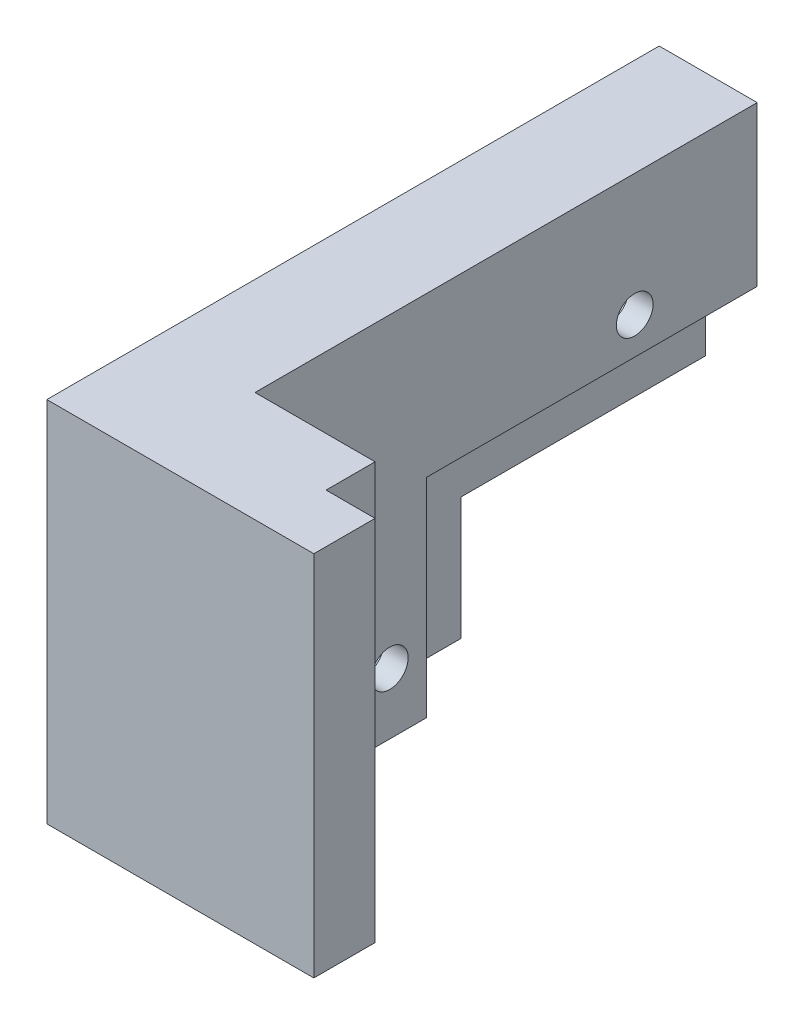
from build123d import *

# Parameters (mm, degrees)
SKETCH_1_W           = 40
SKETCH_1_H           = 30
EXTRUDE_1_DEPTH      = 5
SKETCH_2_W           = 5
SKETCH_2_H           = 30
EXTRUDE_2_DEPTH      = 20
SKETCH_3_W           = 20
SKETCH_3_H           = 30
EXTRUDE_3_DEPTH      = 5
SKETCH_4_W           = 15
SKETCH_4_H           = 30
CUT_EXTRUDE_1_DEPTH  = 5
SKETCH_5_R           = 1.5
CUT_EXTRUDE_2_DEPTH  = 5
SKETCH_6_R           = 3
CUT_EXTRUDE_3_DEPTH  = 2
SKETCH_7_W           = 15
SKETCH_7_H           = 30
CUT_EXTRUDE_4_DEPTH  = 10
SKETCH_8_W           = 5
SKETCH_8_H           = 30
EXTRUDE_4_DEPTH      = 20
SKETCH_10_W          = 30
SKETCH_10_H          = 30
EXTRUDE_5_DEPTH      = 3
SKETCH_11_R          = 1.5
CUT_EXTRUDE_6_DEPTH  = 13
SKETCH_12_R          = 2.9
CUT_EXTRUDE_7_DEPTH  = 6
SKETCH_14_W          = 8
SKETCH_14_H          = 20
EXTRUDE_6_DEPTH      = 20
CUT_EXTRUDE_8_DEPTH  = 4.2
SKETCH_16_R          = 1.5
CUT_EXTRUDE_9_DEPTH  = 14.2
SKETCH_17_R          = 2.9
CUT_EXTRUDE_10_DEPTH = 6
SKETCH_18_W          = 4
SKETCH_18_H          = 30
EXTRUDE_7_DEPTH      = 9.8
SKETCH_19_W          = 5
SKETCH_19_H          = 30
CUT_EXTRUDE_11_DEPTH = 26.2


with BuildPart() as part:
    # 草图1 → 凸台-拉伸1 (new body)
    with BuildSketch(Plane.XY):
        with Locations((-20, 15)):
            Rectangle(SKETCH_1_W, SKETCH_1_H)
    extrude(amount=EXTRUDE_1_DEPTH)

    # 草图2 → 凸台-拉伸2 (add)
    with BuildSketch(Plane.ZY.offset(40)):
        with Locations((2.5, 15)):
            Rectangle(SKETCH_2_W, SKETCH_2_H)
    extrude(amount=EXTRUDE_2_DEPTH)

    # 草图3 → 凸台-拉伸3 (add)
    with BuildSketch(Plane(origin=(0, 0, 0), x_dir=(-1, 0, 0), z_dir=(0, 0, -1))):
        with Locations((50, 15)):
            Rectangle(SKETCH_3_W, SKETCH_3_H)
    extrude(amount=EXTRUDE_3_DEPTH)

    # 草图4 → 切除-拉伸1 (cut)
    with BuildSketch(Plane.XY.offset(5)):
        with Locations((-52.5, 15)):
            Rectangle(SKETCH_4_W, SKETCH_4_H)
    extrude(amount=-CUT_EXTRUDE_1_DEPTH, mode=Mode.SUBTRACT)

    # 草图5 → 切除-拉伸2 (cut)
    with BuildSketch(Plane.XY):
        with Locations((-52.5, 5)):
            Circle(SKETCH_5_R)
        with Locations((-52.5, 25)):
            Circle(SKETCH_5_R)
    extrude(amount=-CUT_EXTRUDE_2_DEPTH, mode=Mode.SUBTRACT)

    # 草图6 → 切除-拉伸3 (cut)
    with BuildSketch(Plane.XY):
        with Locations((-52.5, 25)):
            Circle(SKETCH_6_R)
        with Locations((-52.5, 5)):
            Circle(SKETCH_6_R)
    extrude(amount=-CUT_EXTRUDE_3_DEPTH, mode=Mode.SUBTRACT)

    # 草图7 → 切除-拉伸4 (cut)
    with BuildSketch(Plane.XY):
        with Locations((-52.5, 15)):
            Rectangle(SKETCH_7_W, SKETCH_7_H)
    extrude(amount=-CUT_EXTRUDE_4_DEPTH, mode=Mode.SUBTRACT)

    # 草图8 → 凸台-拉伸4 (add)
    with BuildSketch(Plane(origin=(0, 0, -5), x_dir=(-1, 0, 0), z_dir=(0, 0, -1))):
        with Locations((42.5, 15)):
            Rectangle(SKETCH_8_W, SKETCH_8_H)
    extrude(amount=EXTRUDE_4_DEPTH)

    # 草图10 → 凸台-拉伸5 (add)
    with BuildSketch(Plane.ZY.offset(45)):
        with Locations((-10, 15)):
            Rectangle(SKETCH_10_W, SKETCH_10_H)
    extrude(amount=EXTRUDE_5_DEPTH)

    # 草图11 → 切除-拉伸6 (cut)
    with BuildSketch(Plane.ZY.offset(48)):
        with Locations((-15, 5)):
            Circle(SKETCH_11_R)
    extrude(amount=-CUT_EXTRUDE_6_DEPTH, mode=Mode.SUBTRACT)

    # 草图12 → 切除-拉伸7 (cut)
    with BuildSketch(Plane.ZY.offset(48)):
        with Locations((-15, 5)):
            Circle(SKETCH_12_R)
    extrude(amount=-CUT_EXTRUDE_7_DEPTH, mode=Mode.SUBTRACT)

    # 草图14 → 凸台-拉伸6 (add)
    with BuildSketch(Plane(origin=(0, 0, -25), x_dir=(-1, 0, 0), z_dir=(0, 0, -1))):
        with Locations((44, 20)):
            Rectangle(SKETCH_14_W, SKETCH_14_H)
    extrude(amount=EXTRUDE_6_DEPTH)

    # 草图15 → 切除-拉伸8 (cut)
    with BuildSketch(Plane(origin=(-40, 0, 0), x_dir=(0, 0, -1), z_dir=(1, 0, 0))):
        Polygon((45, 10), (25, 10), (25, 0), (18, 0), (18, 10), (18, 17), (45, 17), align=None)
    extrude(amount=-CUT_EXTRUDE_8_DEPTH, mode=Mode.SUBTRACT)

    # 草图16 → 切除-拉伸9 (cut)
    with BuildSketch(Plane.ZY.offset(48)):
        with Locations((-35, 20)):
            Circle(SKETCH_16_R)
    extrude(amount=-CUT_EXTRUDE_9_DEPTH, mode=Mode.SUBTRACT)

    # 草图17 → 切除-拉伸10 (cut)
    with BuildSketch(Plane.ZY.offset(48)):
        with Locations((-35, 20)):
            Circle(SKETCH_17_R)
    extrude(amount=-CUT_EXTRUDE_10_DEPTH, mode=Mode.SUBTRACT)

    # 草图18 → 凸台-拉伸7 (add)
    with BuildSketch(Plane(origin=(-40, 0, 0), x_dir=(0, 0, -1), z_dir=(1, 0, 0))):
        with Locations((2, 15)):
            Rectangle(SKETCH_18_W, SKETCH_18_H)
    extrude(amount=EXTRUDE_7_DEPTH)

    # 草图19 → 切除-拉伸11 (cut)
    with BuildSketch(Plane(origin=(0, 0, 0), x_dir=(0, 0, -1), z_dir=(1, 0, 0))):
        with Locations((-2.5, 15)):
            Rectangle(SKETCH_19_W, SKETCH_19_H)
    extrude(amount=-CUT_EXTRUDE_11_DEPTH, mode=Mode.SUBTRACT)


solid = part.part
